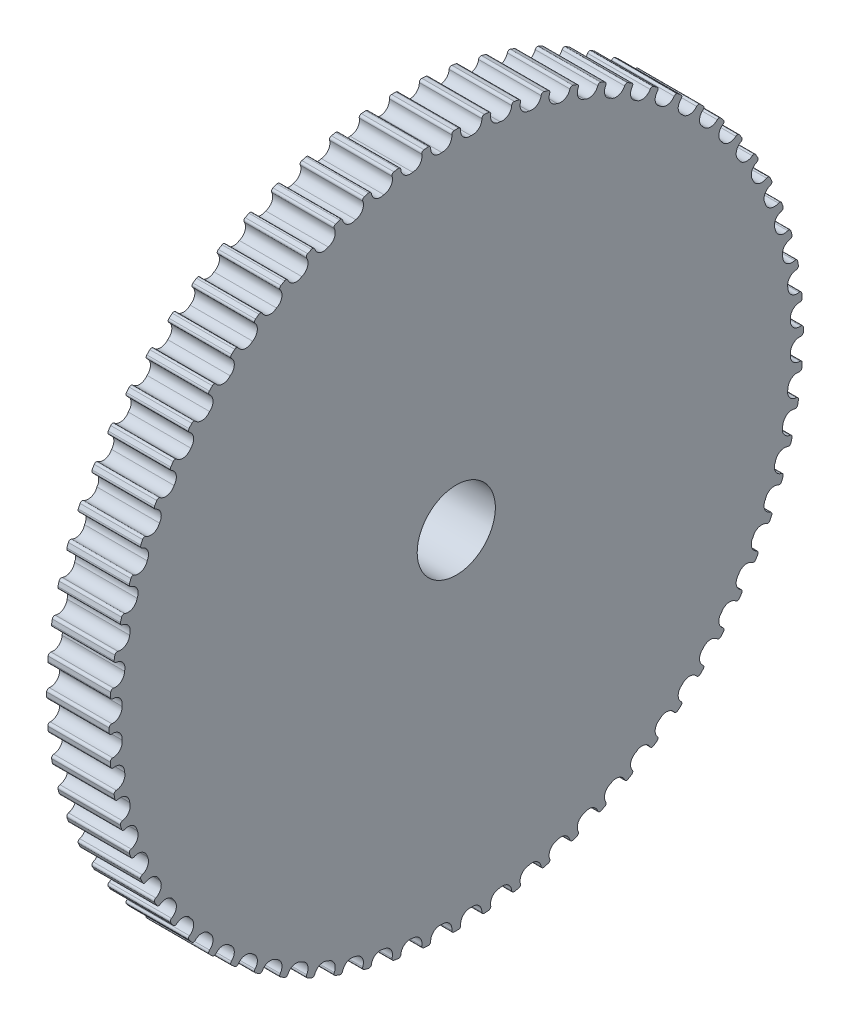
from build123d import *

# Parameters (mm, degrees)
SKETCH3_R               = 57.277
BOSS_EXTRUDE1_DEPTH     = 10.16
CUT_EXTRUDE4_DEPTH      = 82.636603665
CIRPATTERN1_COUNT       = 72
CUT_EXTRUDE5_DEPTH      = 81.413567568
CUT_EXTRUDE5_DEPTH_BACK = 81.413567568
SKETCH4_R               = 6.35


with BuildPart() as part:
    # Sketch3 → Boss-Extrude1 (new body)
    with BuildSketch(Plane(origin=(0, 0, 0), x_dir=(0, 0, -1), z_dir=(1, 0, 0))):
        Circle(SKETCH3_R)
    extrude(amount=BOSS_EXTRUDE1_DEPTH)

    # Sketch5 → Cut-Extrude4 (cut, through all)
    with BuildSketch(Plane.ZY):
        with BuildLine():
            Line((-0.03394819, 56.405302273), (0.34705181, 56.405302273))
            ThreePointArc((0.34705181, 56.405302273), (0.631624177, 56.27763914), (0.725491032, 55.980202893))
            ThreePointArc((0.725491032, 55.980202893), (1.149765904, 54.756277358), (2.371971196, 54.327072152))
            ThreePointArc((2.371971196, 54.327072152), (3.626933325, 54.648121892), (4.156265843, 55.83041203))
            ThreePointArc((4.156265843, 55.83041203), (4.275698783, 56.118535407), (4.570314841, 56.220910627))
            Line((4.570314841, 56.220910627), (4.949865021, 56.187704289))
            Line((4.949865021, 56.187704289), (5.030315007, 57.107251833))
            Line((5.030315007, 57.107251833), (2.50605181, 57.398023115))
            Line((2.50605181, 57.398023115), (-0.03394819, 57.328362339))
            Line((-0.03394819, 57.328362339), (-0.03394819, 56.405302273))
        make_face()
    cut_extrude4 = extrude(amount=-CUT_EXTRUDE4_DEPTH, mode=Mode.SUBTRACT)

    # CirPattern1: Cut-Extrude4 ×72 about axis
    cirpattern1_axis = Axis((0, 0, 0), (1, 0, 0))
    for i in range(1, CIRPATTERN1_COUNT):
        add(cut_extrude4.rotate(cirpattern1_axis, i * 360 / CIRPATTERN1_COUNT), mode=Mode.SUBTRACT)

    # Sketch4 → Cut-Extrude5 (cut, two sides: drawn at the far end of the back side and taken through both)
    with BuildSketch(Plane.ZY.offset(-CUT_EXTRUDE5_DEPTH_BACK)):
        Circle(SKETCH4_R)
    extrude(amount=CUT_EXTRUDE5_DEPTH + CUT_EXTRUDE5_DEPTH_BACK, mode=Mode.SUBTRACT)


solid = part.part
